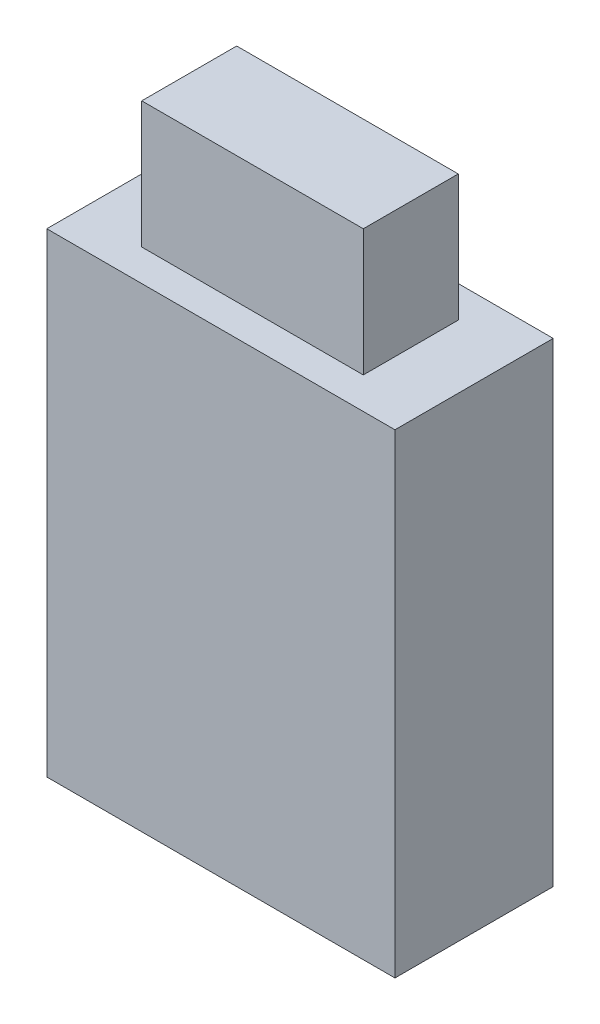
from build123d import *

# Parameters (mm, degrees)
BOSS_EXTRUDE1_START = 56
SKETCH1_W           = 22
SKETCH1_H           = 30
BOSS_EXTRUDE1_DEPTH = 10
BOSS_EXTRUDE2_START = 58
SKETCH2_W           = 14
SKETCH2_H           = 8
BOSS_EXTRUDE2_DEPTH = 6


with BuildPart() as part:
    # Sketch1 → Boss-Extrude1 (new body)
    with BuildSketch(Plane.XY.offset(BOSS_EXTRUDE1_START)):
        with Locations((41, 173)):
            Rectangle(SKETCH1_W, SKETCH1_H)
    extrude(amount=BOSS_EXTRUDE1_DEPTH)

    # Sketch2 → Boss-Extrude2 (add)
    with BuildSketch(Plane.XY.offset(BOSS_EXTRUDE2_START)):
        with Locations((41, 192)):
            Rectangle(SKETCH2_W, SKETCH2_H)
    extrude(amount=BOSS_EXTRUDE2_DEPTH)


solid = part.part
